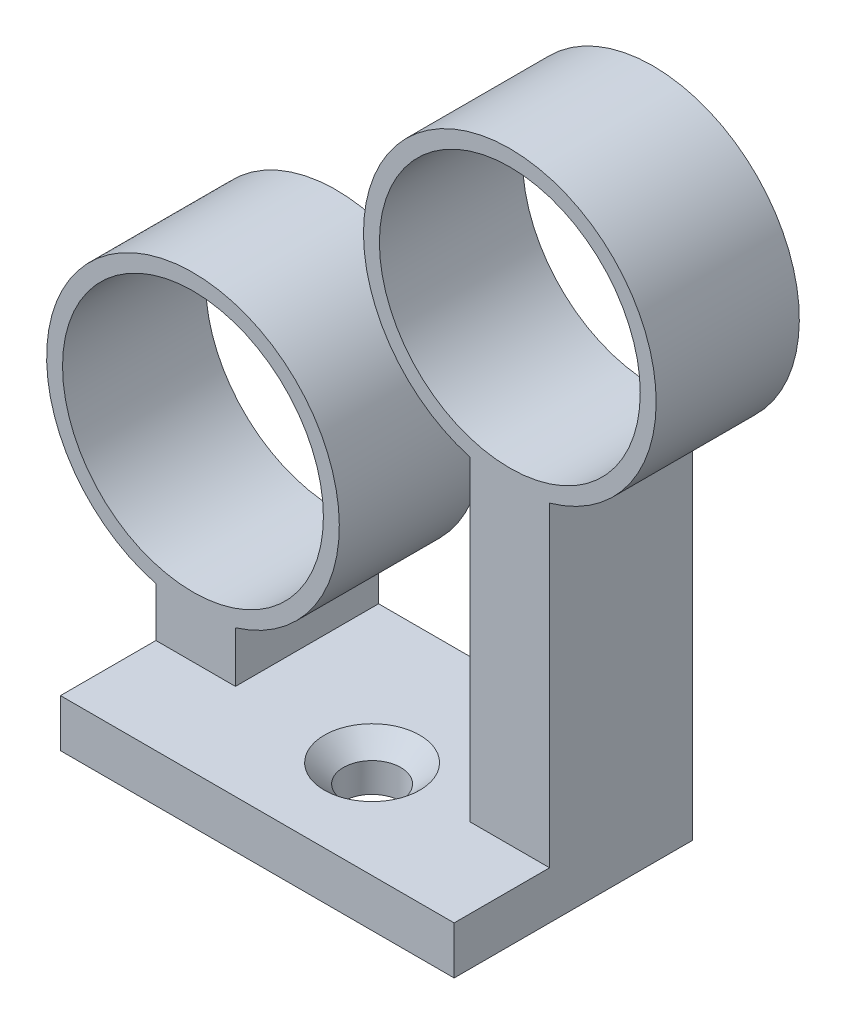
from build123d import *

# Parameters (mm, degrees)
SKETCH1_R             = 9.2
SKETCH1_R_2           = 8.2
BOSS_EXTRUDE1_DEPTH   = 9
BOSS_EXTRUDE1_2_DEPTH = 9
BOSS_EXTRUDE2_DEPTH   = 9
SKETCH3_W             = 24.749470463
SKETCH3_H             = 15
BOSS_EXTRUDE3_DEPTH   = 3


with BuildPart() as part:
    # Sketch1 → Boss-Extrude1 (new body)
    with BuildSketch(Plane.XY):
        with Locations((22.544450453, 56.532786317)):
            Circle(SKETCH1_R)
        with Locations((22.544450453, 56.532786317)):
            Circle(SKETCH1_R_2, mode=Mode.SUBTRACT)
    extrude(amount=BOSS_EXTRUDE1_DEPTH)



with BuildPart() as body_2:
    # Sketch1 → Boss-Extrude1 2 (new body)
    with BuildSketch(Plane.XY):
        with Locations((2.62521603, 39.822786317)):
            Circle(SKETCH1_R)
        with Locations((2.62521603, 39.822786317)):
            Circle(SKETCH1_R_2, mode=Mode.SUBTRACT)
    extrude(amount=BOSS_EXTRUDE1_2_DEPTH)


with BuildPart() as part_1:
    add(part.part)

    add(body_2.part)  # Boss-Extrude2 merges body 2
    # Sketch2 → Boss-Extrude2 (add)
    with BuildSketch(Plane.XY):
        with BuildLine():
            Line((0.29497999, 24.822786317), (5.29497999, 24.822786317))
            Line((5.29497999, 24.822786317), (5.29497999, 31.018675891))
            ThreePointArc((5.29497999, 31.018675891), (2.801620408, 30.624477696), (0.29497999, 30.922786317))
            Line((0.29497999, 30.922786317), (0.29497999, 24.822786317))
        make_face()
        with BuildLine():
            Line((20.044450453, 47.722786317), (20.044450453, 24.822786317))
            Line((20.044450453, 24.822786317), (25.044450453, 24.822786317))
            Line((25.044450453, 24.822786317), (25.044450453, 47.722786317))
            ThreePointArc((25.044450453, 47.722786317), (22.544450453, 47.332786317), (20.044450453, 47.722786317))
        make_face()
    extrude(amount=BOSS_EXTRUDE2_DEPTH)

    # Sketch3 → Boss-Extrude3 (add)
    with BuildSketch(Plane.XZ.offset(-24.822786317)):
        with Locations((12.669715222, 7.5)):
            Rectangle(SKETCH3_W, SKETCH3_H)
    extrude(amount=-BOSS_EXTRUDE3_DEPTH)

    # Sketch4 → Avellanado para tornillo con cabeza avellanada en cruz de M31 (revolve, cut)
    with BuildSketch(Plane(origin=(13.742024433, 27.822786317, 8.856342487), x_dir=(0, 0, 1), z_dir=(1, 0, 0))):
        Polygon((0, 0), (0, 11.081549114), (1.8, 10), (1.8, 1.15882653), (3, 0), align=None)
    revolve(axis=Axis((13.742024433, 34.172786317, 8.856342487), (0, -1, 0)), mode=Mode.SUBTRACT)


solid = part_1.part
